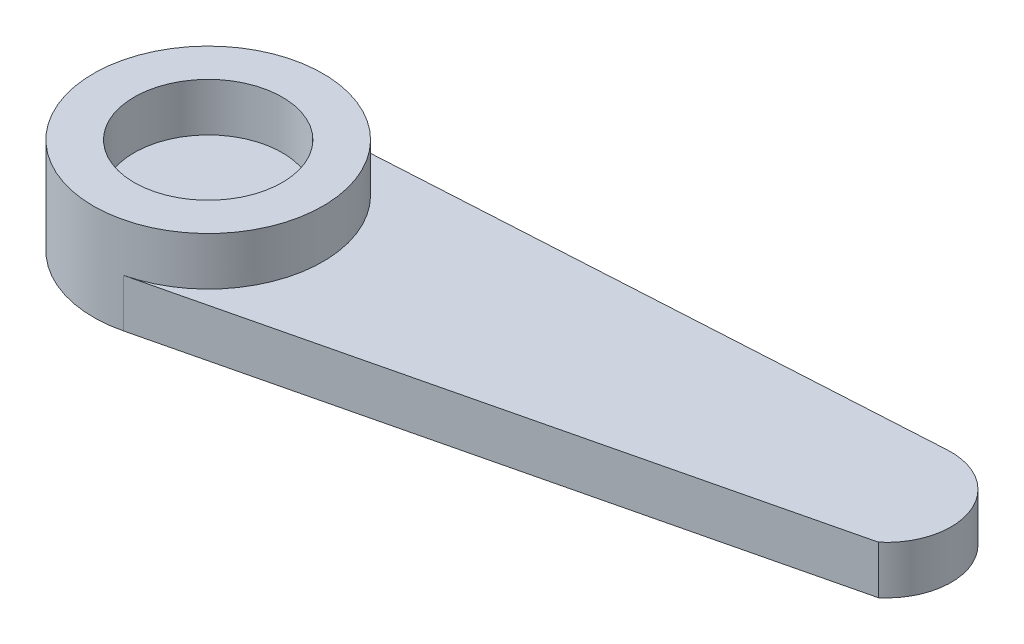
from build123d import *
from build123d.topology import SkipClean

# Parameters (mm, degrees)
BOSS_EXTRUDE1_DEPTH = 1.3
SKETCH2_R           = 3.1
SKETCH2_R_2         = 2
BOSS_EXTRUDE2_DEPTH = 1.3


with BuildPart() as part:
    # Sketch1 → Boss-Extrude1 (new body)
    with BuildSketch(Plane(origin=(0, 0, 0), x_dir=(1, 0, 0), z_dir=(0, 1, 0))):
        with BuildLine():
            Line((-0.178960564, 3.094830063), (15.932363725, 4.026477881))
            ThreePointArc((15.932363725, 4.026477881), (17.659689309, 2.925654907), (17.159069655, 0.939491555))
            Line((17.159069655, 0.939491555), (0.725076499, -3.014011292))
            ThreePointArc((0.725076499, -3.014011292), (-3.066601756, -0.453821189), (-0.178960564, 3.094830063))
        make_face()
    extrude(amount=BOSS_EXTRUDE1_DEPTH)

    # Sketch2 → Boss-Extrude2 (add)
    with SkipClean():  # the faces are left unmerged after this step: merging them gives an invalid solid
        with BuildSketch(Plane(origin=(0, 1.3, 0), x_dir=(1, 0, 0), z_dir=(0, 1, 0))):
            with Locations(Location((0, 0, 0), (0, 0, 93.309480289))):
                Circle(SKETCH2_R)
            with Locations(Location((0, 0, 0), (0, 0, 270))):
                Circle(SKETCH2_R_2, mode=Mode.SUBTRACT)
        extrude(amount=BOSS_EXTRUDE2_DEPTH)


solid = part.part
